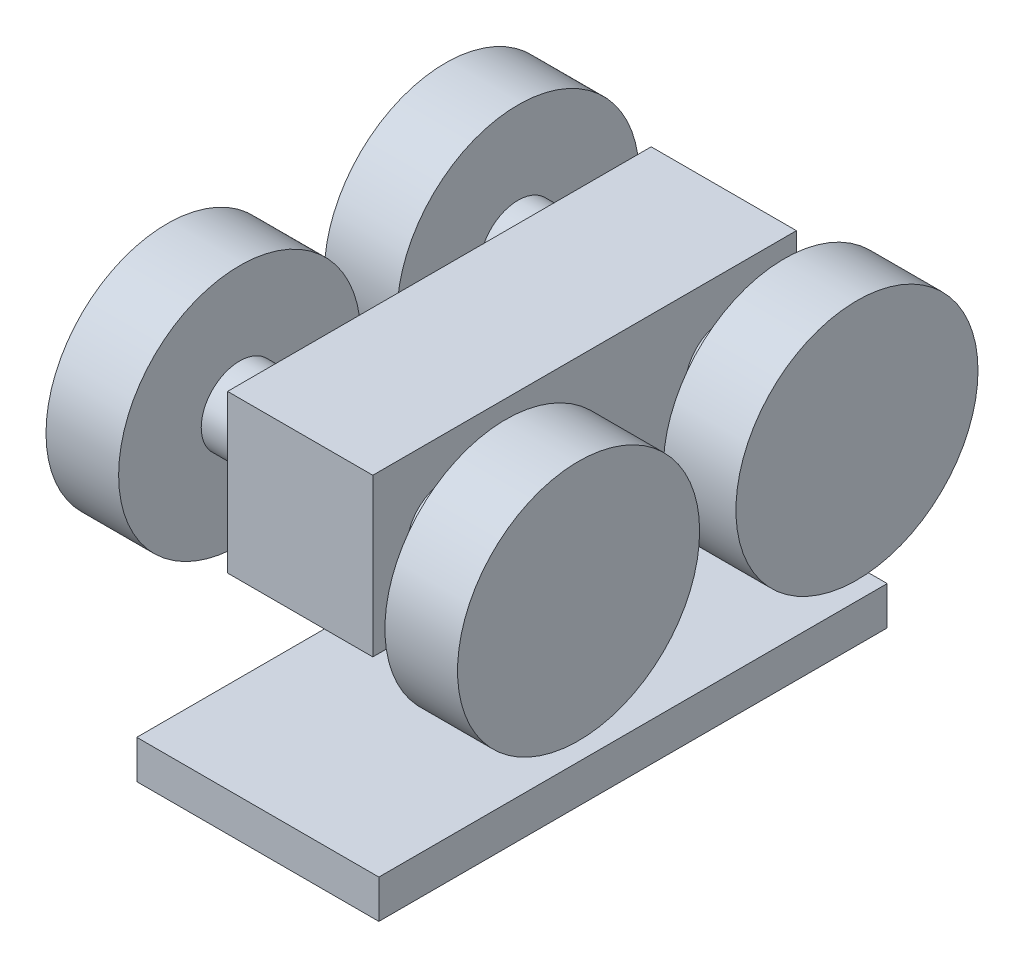
from build123d import *

# Parameters (mm, degrees)
CROQUIS1_W              = 20
CROQUIS1_H              = 42
SALIENTE_EXTRUIR1_DEPTH = 3.175
CROQUIS2_R              = 3.175
SALIENTE_EXTRUIR2_DEPTH = 12
CROQUIS3_W              = 12
CROQUIS3_H              = 35
SALIENTE_EXTRUIR3_DEPTH = 13
CROQUIS4_R              = 3.175
SALIENTE_EXTRUIR4_DEPTH = 11
SALIENTE_EXTRUIR5_START = 11
CROQUIS5_R              = 3.175
SALIENTE_EXTRUIR5_DEPTH = 11
SALIENTE_EXTRUIR6_START = -6
CROQUIS6_R              = 10
CROQUIS6_R_2            = 3.175
SALIENTE_EXTRUIR6_DEPTH = 6
CROQUIS7_R              = 10
CROQUIS7_R_2            = 3.175
SALIENTE_EXTRUIR7_DEPTH = 6


with BuildPart() as part:
    # Croquis1 → Saliente-Extruir1 (new body)
    with BuildSketch(Plane(origin=(0, 0, 0), x_dir=(1, 0, 0), z_dir=(0, 1, 0))):
        with Locations((10, -21)):
            Rectangle(CROQUIS1_W, CROQUIS1_H)
    extrude(amount=SALIENTE_EXTRUIR1_DEPTH)

    # Croquis2 → Saliente-Extruir2 (add)
    with BuildSketch(Plane(origin=(0, 3.175, 0), x_dir=(1, 0, 0), z_dir=(0, 1, 0))):
        with Locations(Location((10, -21, 0), (0, 0, 270))):
            Circle(CROQUIS2_R)
    extrude(amount=SALIENTE_EXTRUIR2_DEPTH)

    # Croquis3 → Saliente-Extruir3 (add)
    with BuildSketch(Plane(origin=(0, 15.175, 0), x_dir=(1, 0, 0), z_dir=(0, 1, 0))):
        with Locations((10, -21)):
            Rectangle(CROQUIS3_W, CROQUIS3_H)
    extrude(amount=SALIENTE_EXTRUIR3_DEPTH)

    # Croquis4 → Saliente-Extruir4 (add)
    with BuildSketch(Plane.ZY.offset(-4)):
        with Locations(Location((9.5, 21.675, 0), (0, 0, 180))):
            Circle(CROQUIS4_R)
        with Locations(Location((32.5, 21.675, 0), (0, 0, 180))):
            Circle(CROQUIS4_R)
    extrude(amount=SALIENTE_EXTRUIR4_DEPTH)

    # Croquis5 → Saliente-Extruir5 (add)
    with BuildSketch(Plane(origin=(16, 0, 0), x_dir=(0, 0, -1), z_dir=(1, 0, 0)).offset(SALIENTE_EXTRUIR5_START)):
        with Locations((-32.5, 21.675)):
            Circle(CROQUIS5_R)
        with Locations((-9.5, 21.675)):
            Circle(CROQUIS5_R)
    extrude(amount=-SALIENTE_EXTRUIR5_DEPTH)

    # Croquis6 → Saliente-Extruir6 (add)
    # profile 1 of 2: a face of its own
    with BuildSketch(Plane.ZY.offset(7).offset(SALIENTE_EXTRUIR6_START)):
        with Locations((9.5, 21.675)):
            Circle(CROQUIS6_R)
        with Locations(Location((9.5, 21.675, 0), (0, 0, 180))):
            Circle(CROQUIS6_R_2, mode=Mode.SUBTRACT)
    # profile 2 of 2: a face of its own
    with BuildSketch(Plane.ZY.offset(7).offset(SALIENTE_EXTRUIR6_START)):
        with Locations((32.5, 21.675)):
            Circle(CROQUIS6_R)
        with Locations(Location((32.5, 21.675, 0), (0, 0, 180))):
            Circle(CROQUIS6_R_2, mode=Mode.SUBTRACT)
    extrude(amount=SALIENTE_EXTRUIR6_DEPTH)

    # Croquis7 → Saliente-Extruir7 (add)
    # profile 1 of 2: a face of its own
    with BuildSketch(Plane(origin=(27, 0, 0), x_dir=(0, 0, -1), z_dir=(1, 0, 0))):
        with Locations(Location((-32.5, 21.675, 0), (0, 0, 180))):
            Circle(CROQUIS7_R)
        with Locations(Location((-32.5, 21.675, 0), (0, 0, 180))):
            Circle(CROQUIS7_R_2, mode=Mode.SUBTRACT)
    # profile 2 of 2: a face of its own
    with BuildSketch(Plane(origin=(27, 0, 0), x_dir=(0, 0, -1), z_dir=(1, 0, 0))):
        with Locations(Location((-9.5, 21.675, 0), (0, 0, 180))):
            Circle(CROQUIS7_R)
        with Locations(Location((-9.5, 21.675, 0), (0, 0, 180))):
            Circle(CROQUIS7_R_2, mode=Mode.SUBTRACT)
    extrude(amount=-SALIENTE_EXTRUIR7_DEPTH)


solid = part.part
